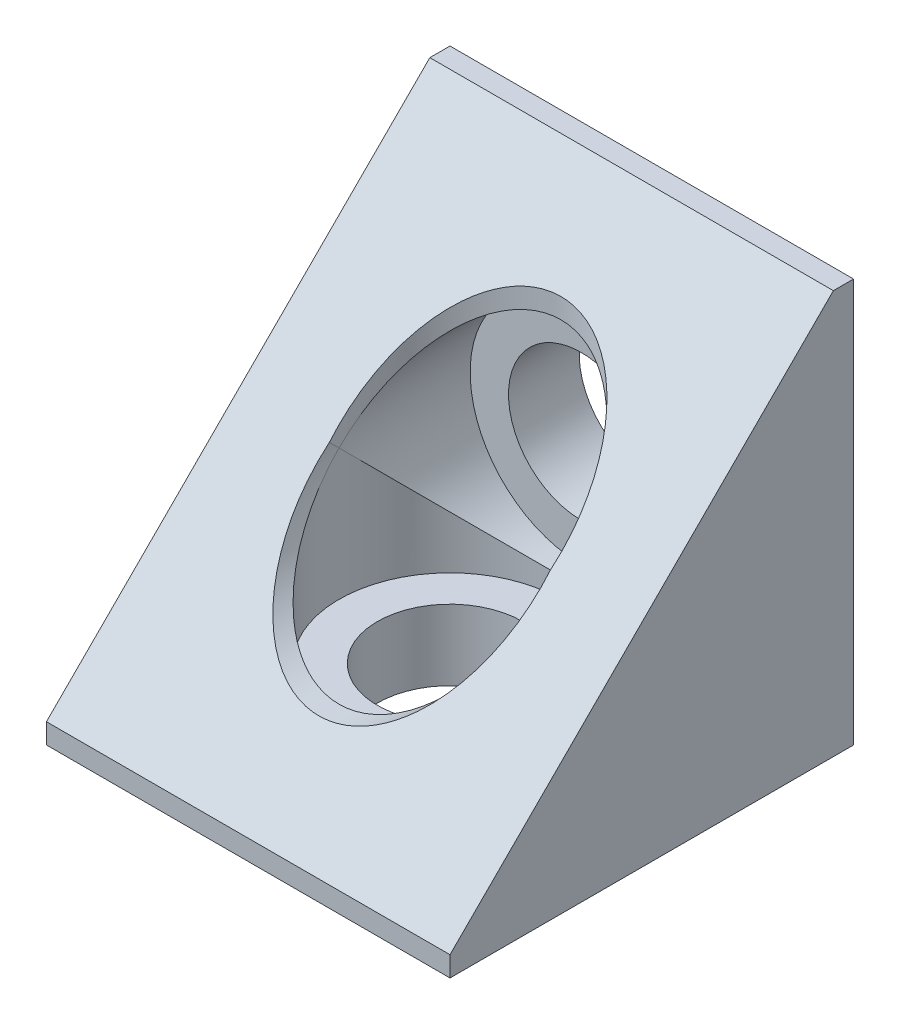
from build123d import *

# Parameters (mm, degrees)
BOSS_EXTRUDE1_DEPTH = 20
HOLE1_D             = 7.2
HOLE1_CBORE_D       = 11
HOLE1_CBORE_DEPTH   = 13


with BuildPart() as part:
    # Sketch1 → Boss-Extrude1 (new body)
    with BuildSketch(Plane(origin=(-10, 0, 0), x_dir=(0, -1, 0), z_dir=(-1, 0, 0))):
        Polygon((9, 10), (-10, -9), (-10, -10), (10, -10), (10, 10), align=None)
    extrude(amount=-BOSS_EXTRUDE1_DEPTH)

    # Sketch2 → Cut-Revolve1 (revolve, cut)
    with BuildSketch(Plane(origin=(0, 0, 0), x_dir=(0, 0, -1), z_dir=(1, 0, 0))):
        Polygon((5.5, 6.5), (0, 6.5), (0, -10), (3.6, -10), (3.6, -6.5), (5.5, -6.5), align=None)
    revolve(axis=Axis((0, 6.5, 0), (0, -1, 0)), mode=Mode.SUBTRACT)

    # Hole1 (through all)
    with Locations(Plane.XY.offset(6.5)):
        with Locations((0, 0)):
            CounterBoreHole(HOLE1_D / 2, HOLE1_CBORE_D / 2, HOLE1_CBORE_DEPTH)


solid = part.part
